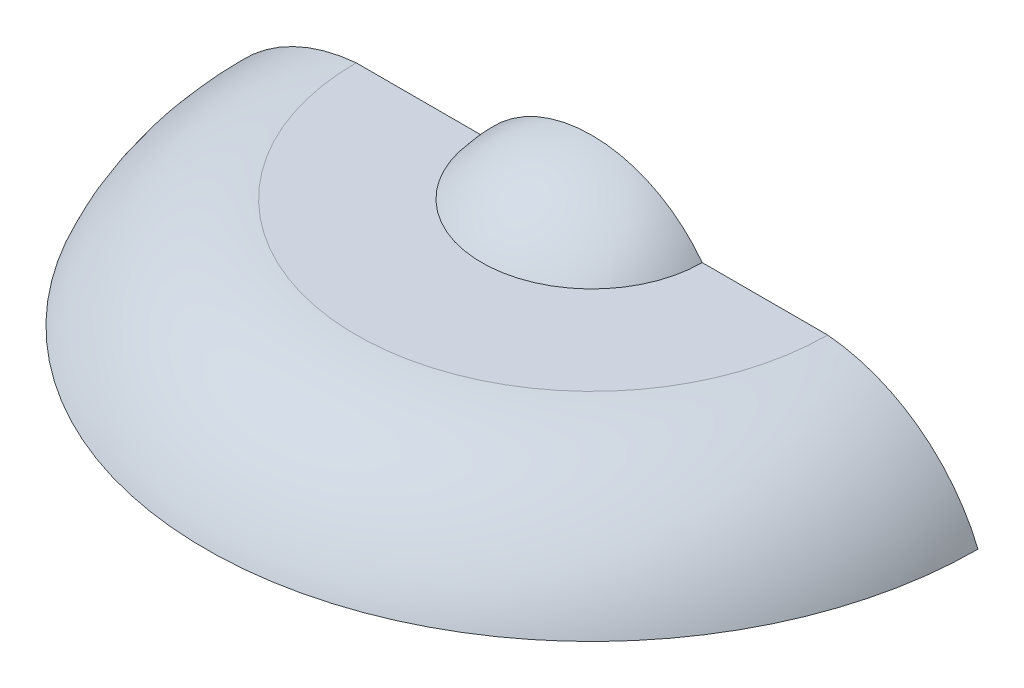
from build123d import *

# Parameters (mm, degrees)
REVOLVE1_ANGLE = 180


with BuildPart() as part:
    # Sketch1 → Revolve1 (revolve)
    with BuildSketch(Plane.XY):
        with BuildLine():
            Line((0, 0), (88.9, 0))
            ThreePointArc((88.9, 0), (75.152492306, 17.556465407), (54.279006481, 25.4))
            Line((54.279006481, 25.4), (25.4, 25.4))
            ThreePointArc((25.4, 25.4), (14.199031657, 34.748063314), (0, 38.1))
            Line((0, 38.1), (0, 0))
        make_face()
    revolve(axis=Axis((0, 38.1, 0), (0, -1, 0)), revolution_arc=REVOLVE1_ANGLE)


solid = part.part
